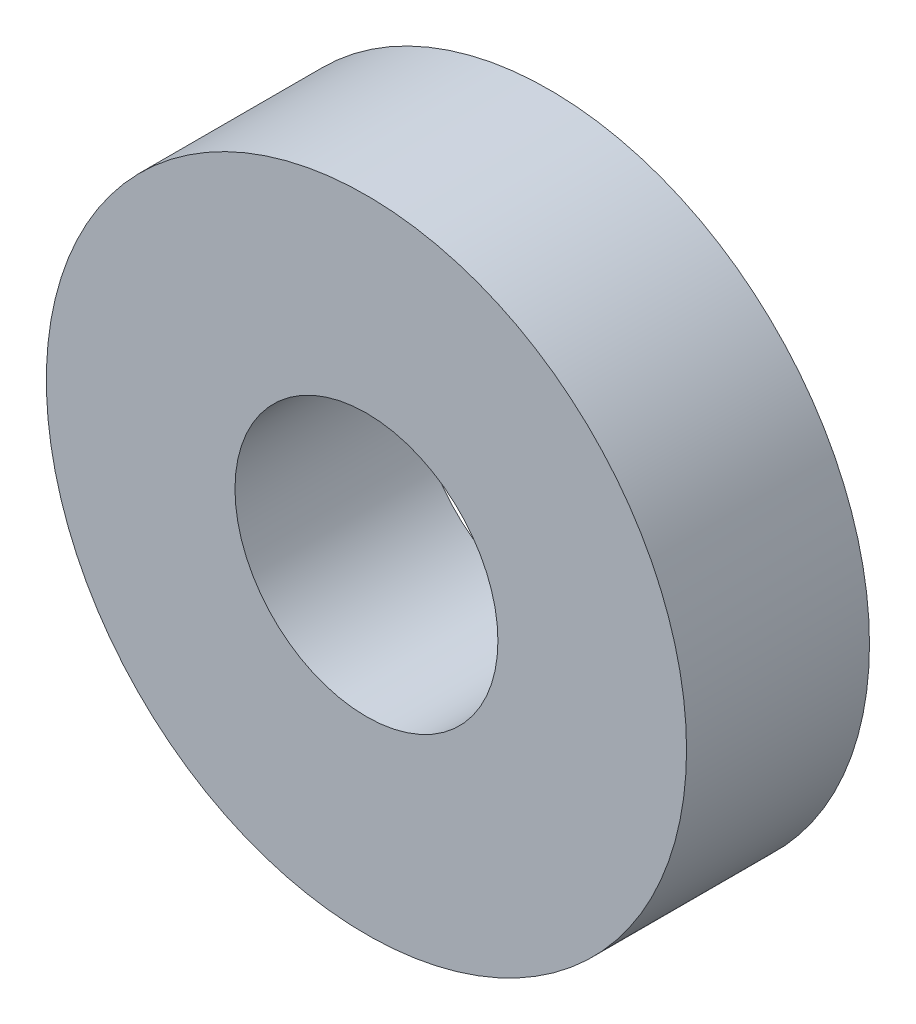
from build123d import *

# Parameters (mm, degrees)
CROQUIS1_R              = 14
CROQUIS1_R_2            = 5.75
SALIENTE_EXTRUIR1_DEPTH = 8


with BuildPart() as part:
    # Croquis1 → Saliente-Extruir1 (new body)
    with BuildSketch(Plane.XY):
        Circle(CROQUIS1_R)
        Circle(CROQUIS1_R_2, mode=Mode.SUBTRACT)
    extrude(amount=SALIENTE_EXTRUIR1_DEPTH)


solid = part.part
